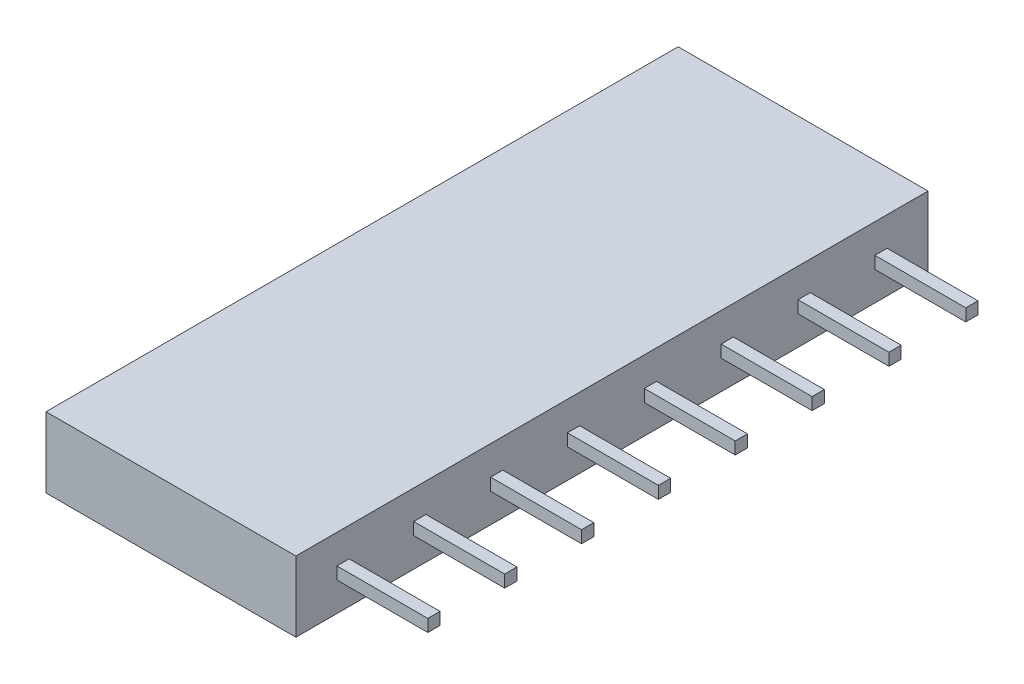
from build123d import *

# Parameters (mm, degrees)
SKETCH1_W           = 8.38
SKETCH1_H           = 21.2
BOSS_EXTRUDE1_DEPTH = 2.36
SKETCH2_W           = 0.41
SKETCH2_H           = 0.41
BOSS_EXTRUDE2_DEPTH = 3.05
SKETCH3_W           = 0.65
SKETCH3_H           = 0.65
CUT_EXTRUDE1_DEPTH  = 3.05


with BuildPart() as part:
    # Sketch1 → Boss-Extrude1 (new body)
    with BuildSketch(Plane(origin=(0, 0, 0), x_dir=(1, 0, 0), z_dir=(0, 1, 0))):
        with Locations((4.19, 10.6)):
            Rectangle(SKETCH1_W, SKETCH1_H)
    extrude(amount=BOSS_EXTRUDE1_DEPTH)

    # Sketch2 → Boss-Extrude2 (add)
    with BuildSketch(Plane(origin=(8.38, 0, 0), x_dir=(0, 0, -1), z_dir=(1, 0, 0))):
        with Locations((1.58, 1.18)):
            Rectangle(SKETCH2_W, SKETCH2_H)
        with Locations((4.157142857, 1.18)):
            Rectangle(SKETCH2_W, SKETCH2_H)
        with Locations((6.734285714, 1.18)):
            Rectangle(SKETCH2_W, SKETCH2_H)
        with Locations((9.311428571, 1.18)):
            Rectangle(SKETCH2_W, SKETCH2_H)
        with Locations((11.888571429, 1.18)):
            Rectangle(SKETCH2_W, SKETCH2_H)
        with Locations((14.465714286, 1.18)):
            Rectangle(SKETCH2_W, SKETCH2_H)
        with Locations((17.042857143, 1.18)):
            Rectangle(SKETCH2_W, SKETCH2_H)
        with Locations((19.62, 1.18)):
            Rectangle(SKETCH2_W, SKETCH2_H)
    extrude(amount=BOSS_EXTRUDE2_DEPTH)

    # Sketch3 → Cut-Extrude1 (cut)
    with BuildSketch(Plane.ZY):
        with Locations((-19.475, 1.18)):
            Rectangle(SKETCH3_W, SKETCH3_H)
        with Locations((-16.939285714, 1.18)):
            Rectangle(SKETCH3_W, SKETCH3_H)
        with Locations((-14.403571429, 1.18)):
            Rectangle(SKETCH3_W, SKETCH3_H)
        with Locations((-11.867857143, 1.18)):
            Rectangle(SKETCH3_W, SKETCH3_H)
        with Locations((-9.332142857, 1.18)):
            Rectangle(SKETCH3_W, SKETCH3_H)
        with Locations((-6.796428571, 1.18)):
            Rectangle(SKETCH3_W, SKETCH3_H)
        with Locations((-4.260714286, 1.18)):
            Rectangle(SKETCH3_W, SKETCH3_H)
        with Locations((-1.725, 1.18)):
            Rectangle(SKETCH3_W, SKETCH3_H)
    extrude(amount=-CUT_EXTRUDE1_DEPTH, mode=Mode.SUBTRACT)


solid = part.part
